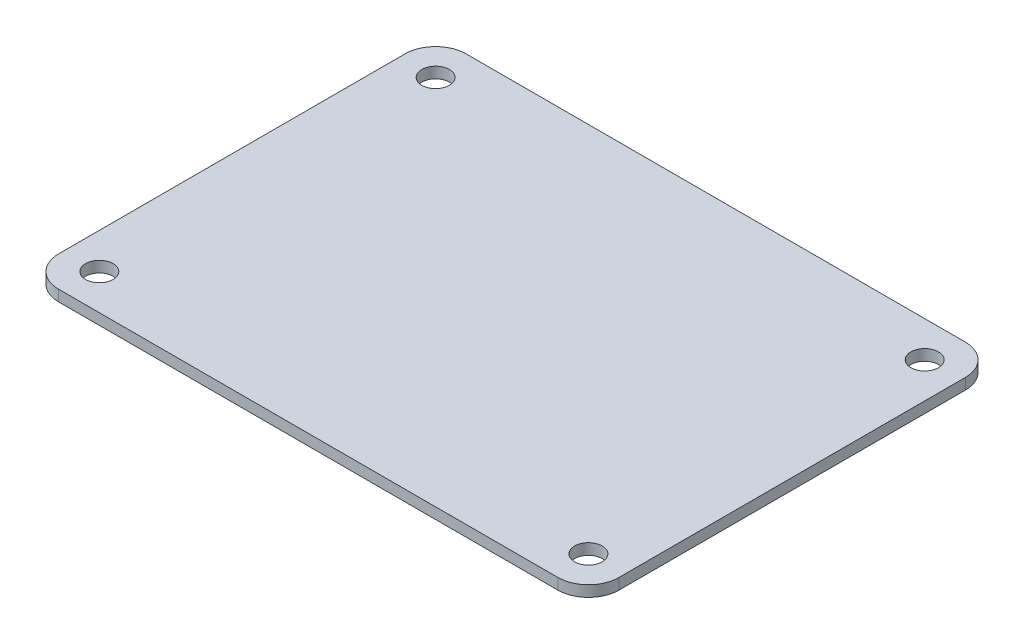
from build123d import *

# Parameters (mm, degrees)
SKETCH1_R           = 1.35
BOSS_EXTRUDE1_DEPTH = 1.08


with BuildPart() as part:
    # Sketch1 → Boss-Extrude1 (new body)
    with BuildSketch(Plane(origin=(0, 0, 0), x_dir=(1, 0, 0), z_dir=(0, 1, 0))):
        with BuildLine():
            Line((-24.5, -20), (24.5, -20))
            ThreePointArc((24.5, -20), (26.621320344, -19.121320344), (27.5, -17))
            Line((27.5, -17), (27.5, 17))
            ThreePointArc((27.5, 17), (26.621320344, 19.121320344), (24.5, 20))
            Line((24.5, 20), (-24.5, 20))
            ThreePointArc((-24.5, 20), (-26.621320344, 19.121320344), (-27.5, 17))
            Line((-27.5, 17), (-27.5, -17))
            ThreePointArc((-27.5, -17), (-26.621320344, -19.121320344), (-24.5, -20))
        make_face()
        with Locations(Location((-24, 16.5, 0), (0, 0, 270))):
            Circle(SKETCH1_R, mode=Mode.SUBTRACT)
        with Locations(Location((-24, -16.5, 0), (0, 0, 270))):
            Circle(SKETCH1_R, mode=Mode.SUBTRACT)
        with Locations(Location((24, 16.5, 0), (0, 0, 270))):
            Circle(SKETCH1_R, mode=Mode.SUBTRACT)
        with Locations(Location((24, -16.5, 0), (0, 0, 270))):
            Circle(SKETCH1_R, mode=Mode.SUBTRACT)
    extrude(amount=BOSS_EXTRUDE1_DEPTH)


solid = part.part
